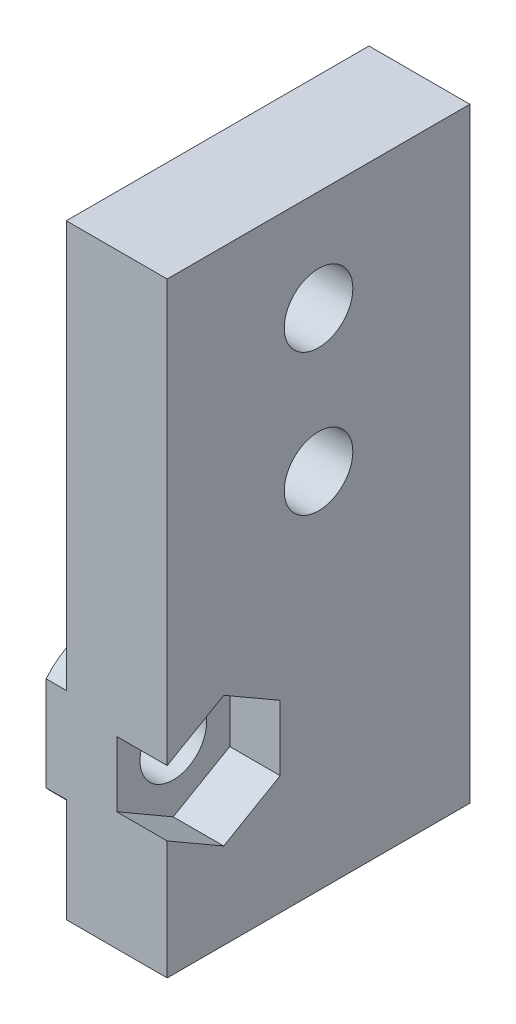
from build123d import *
from build123d.topology import SkipClean

# Parameters (mm, degrees)
SKETCH1_R           = 1.7
BOSS_EXTRUDE1_DEPTH = 2.5
BOSS_EXTRUDE2_START = -2.5
SKETCH1_3_R         = 1.6
SKETCH1_3_R_2       = 1.7
SKETCH1_3_R_3       = 1.65
BOSS_EXTRUDE2_DEPTH = 2.5
BOSS_EXTRUDE3_START = 1
SKETCH4_R           = 1.65
BOSS_EXTRUDE3_DEPTH = 1


with BuildPart() as part:
    # Sketch1 → Boss-Extrude1 (new body)
    with BuildSketch(Plane(origin=(0, 0, 0), x_dir=(0, 0, -1), z_dir=(1, 0, 0))):
        Polygon((0, 5.883419246), (0, 0), (15, 0), (15, 30), (0, 30), (0, 9.116580754), (2.8, 10.733161507), (5.6, 9.116580754), (5.6, 5.883419246), (2.8, 4.266838493), align=None)
        with Locations((7.5, 25)):
            Circle(SKETCH1_R, mode=Mode.SUBTRACT)
        with Locations((7.5, 18)):
            Circle(SKETCH1_R, mode=Mode.SUBTRACT)
    extrude(amount=BOSS_EXTRUDE1_DEPTH)

    # Sketch1<3> → Boss-Extrude2 (add)
    # profile 1 of 7: a face of its own
    with SkipClean():  # the faces are left unmerged after this step: merging them gives an invalid solid
        with BuildSketch(Plane(origin=(0, 0, 0), x_dir=(0, 0, -1), z_dir=(1, 0, 0)).offset(BOSS_EXTRUDE2_START)):
            Polygon((0, 5.883419246), (0, 0), (15, 0), (15, 30), (0, 30), (0, 9.116580754), (2.8, 10.733161507), (5.6, 9.116580754), (5.6, 5.883419246), (2.8, 4.266838493), align=None)
            with Locations((7.5, 7.5)):
                Circle(SKETCH1_3_R, mode=Mode.SUBTRACT)
            with Locations((7.5, 25)):
                Circle(SKETCH1_3_R_2, mode=Mode.SUBTRACT)
            with BuildLine():
                ThreePointArc((6.189201102, 19.0825), (7.019000123, 21.525987915), (9.1, 20))
                ThreePointArc((9.1, 20), (9.025987915, 19.519000123), (8.810798898, 19.0825))
                ThreePointArc((8.810798898, 19.0825), (9.099743437, 18.575170355), (9.2, 18))
                ThreePointArc((9.2, 18), (6.924829645, 16.400256563), (6.189201102, 19.0825))
            make_face(mode=Mode.SUBTRACT)
        # profile 2 of 7: a face of its own
        with BuildSketch(Plane(origin=(0, 0, 0), x_dir=(0, 0, -1), z_dir=(1, 0, 0)).offset(BOSS_EXTRUDE2_START)):
            Polygon((0, 5.883419246), (0, 0), (15, 0), (15, 30), (0, 30), (0, 9.116580754), (2.8, 10.733161507), (5.6, 9.116580754), (5.6, 5.883419246), (2.8, 4.266838493), align=None)
            with Locations((7.5, 7.5)):
                Circle(SKETCH1_3_R, mode=Mode.SUBTRACT)
            with Locations((7.5, 25)):
                Circle(SKETCH1_3_R_2, mode=Mode.SUBTRACT)
            with BuildLine():
                ThreePointArc((6.189201102, 19.0825), (7.019000123, 21.525987915), (9.1, 20))
                ThreePointArc((9.1, 20), (9.025987915, 19.519000123), (8.810798898, 19.0825))
                ThreePointArc((8.810798898, 19.0825), (9.099743437, 18.575170355), (9.2, 18))
                ThreePointArc((9.2, 18), (6.924829645, 16.400256563), (6.189201102, 19.0825))
            make_face(mode=Mode.SUBTRACT)
        # profile 3 of 7: a face of its own
        with BuildSketch(Plane(origin=(0, 0, 0), x_dir=(0, 0, -1), z_dir=(1, 0, 0)).offset(BOSS_EXTRUDE2_START)):
            Polygon((0, 9.116580754), (0, 5.883419246), (2.8, 4.266838493), (5.6, 5.883419246), (5.6, 9.116580754), (2.8, 10.733161507), align=None)
            with Locations((2.8, 7.5)):
                Circle(SKETCH1_3_R_3, mode=Mode.SUBTRACT)
        # profile 4 of 7: a face of its own
        with BuildSketch(Plane(origin=(0, 0, 0), x_dir=(0, 0, -1), z_dir=(1, 0, 0)).offset(BOSS_EXTRUDE2_START)):
            with Locations((7.5, 7.5)):
                Circle(SKETCH1_3_R)
        # profile 5 of 7: a face of its own
        with BuildSketch(Plane(origin=(0, 0, 0), x_dir=(0, 0, -1), z_dir=(1, 0, 0)).offset(BOSS_EXTRUDE2_START)):
            with Locations((7.5, 7.5)):
                Circle(SKETCH1_3_R)
        # profile 6 of 7: a face of its own
        with BuildSketch(Plane(origin=(0, 0, 0), x_dir=(0, 0, -1), z_dir=(1, 0, 0)).offset(BOSS_EXTRUDE2_START)):
            with BuildLine():
                ThreePointArc((8.810798898, 19.0825), (9.025987915, 19.519000123), (9.1, 20))
                ThreePointArc((9.1, 20), (7.019000123, 21.525987915), (6.189201102, 19.0825))
                ThreePointArc((6.189201102, 19.0825), (7.5, 19.7), (8.810798898, 19.0825))
            make_face()
        # profile 7 of 7: a face of its own
        with BuildSketch(Plane(origin=(0, 0, 0), x_dir=(0, 0, -1), z_dir=(1, 0, 0)).offset(BOSS_EXTRUDE2_START)):
            with BuildLine():
                ThreePointArc((8.810798898, 19.0825), (9.025987915, 19.519000123), (9.1, 20))
                ThreePointArc((9.1, 20), (7.019000123, 21.525987915), (6.189201102, 19.0825))
                ThreePointArc((6.189201102, 19.0825), (7.5, 19.7), (8.810798898, 19.0825))
            make_face()
        extrude(amount=BOSS_EXTRUDE2_DEPTH)

    # Sketch4 → Boss-Extrude3 (add)
    with BuildSketch(Plane.ZY.offset(2.5).offset(BOSS_EXTRUDE3_START)):
        with BuildLine():
            Line((0, 5.158526105), (0, 9.841473895))
            ThreePointArc((0, 9.841473895), (-6.45, 7.5), (0, 5.158526105))
        make_face()
        with Locations(Location((-2.8, 7.5, 0), (0, 0, 180))):
            Circle(SKETCH4_R, mode=Mode.SUBTRACT)
    extrude(amount=-BOSS_EXTRUDE3_DEPTH)


solid = part.part
